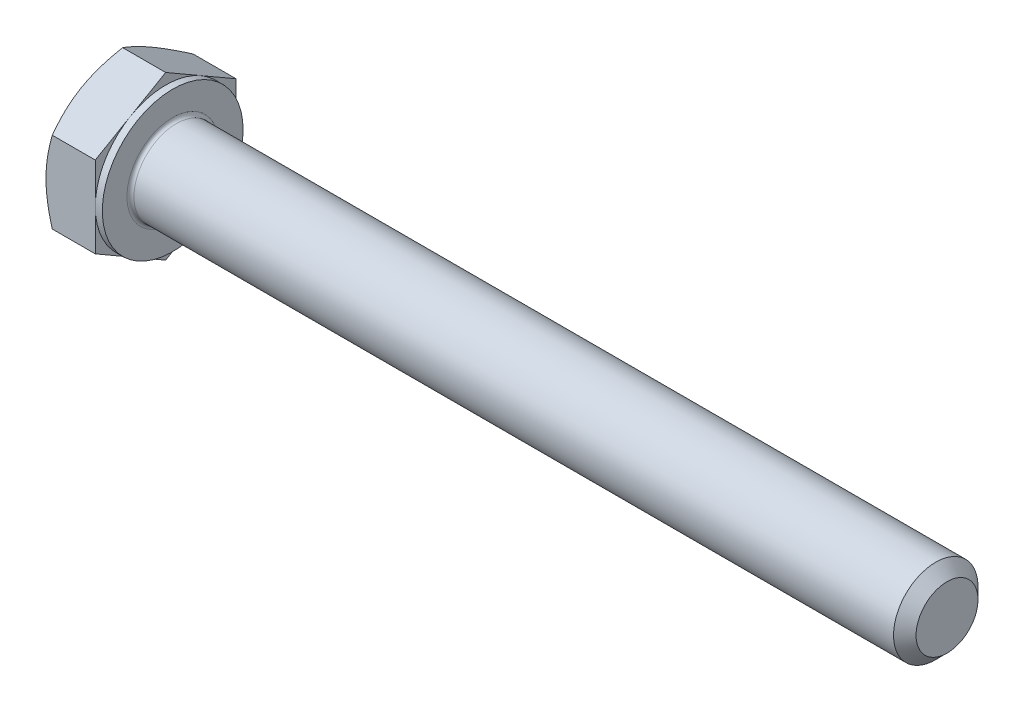
from build123d import *

# Parameters (mm, degrees)
EXTRUDE_370_DEPTH = 4
SKETCH_4_W        = 0.5
SKETCH_4_H        = 10.773502692
CHAMFER_2030_SIZE = 0.8
FILLET_2072_R     = 0.25


with BuildPart() as part:
    # 草图1 → Extrude 370 (new body)
    with BuildSketch(Plane(origin=(0, 0, 0), x_dir=(0, 0, -1), z_dir=(1, 0, 0))):
        Polygon((5, 2.886751346), (5, -2.886751346), (0, -5.773502692), (-5, -2.886751346), (-5, 2.886751346), (0, 5.773502692), align=None)
    extrude(amount=EXTRUDE_370_DEPTH)

    # 草图2 → 凸台-旋转1 (revolve)
    with BuildSketch(Plane.XY, mode=Mode.PRIVATE) as revolve_1_sk:
        Polygon((0, 0), (59, 0), (59, 2.134), (59, 3), (27.8072, 3), (0, 3), align=None)
    revolve(revolve_1_sk.sketch.rotate(Axis((0, 0, 0), (1, 0, 0)), 90), axis=Axis((0, 0, 0), (1, 0, 0)))

    # 草图3 → 切除-旋转1 (revolve, cut)
    with BuildSketch(Plane.XY):
        Polygon((0, 5), (3.333333333, 10.773502692), (3.333333333, 15.773502692), (-10, 15.773502692), (-10, 5), align=None)
    revolve(axis=Axis((0, 0, 0), (1, 0, 0)), mode=Mode.SUBTRACT)

    # 草图5 → 切除-旋转2 (revolve, cut)
    with BuildSketch(Plane.XY):
        Polygon((4, 5), (0.666666667, 10.773502692), (0.666666667, 15.773502692), (10.666666667, 15.773502692), (10.666666667, 5), align=None)
    revolve(axis=Axis((0, 0, 0), (1, 0, 0)), mode=Mode.SUBTRACT)

    # 草图4 → 切除-旋转3 (revolve, cut)
    with BuildSketch(Plane.XY, mode=Mode.PRIVATE) as cut_revolve_3_sk:
        with Locations((3.75, 10.386751346)):
            Rectangle(SKETCH_4_W, SKETCH_4_H)
    revolve(cut_revolve_3_sk.sketch.rotate(Axis((0, 0, 0), (1, 0, 0)), 270), axis=Axis((0, 0, 0), (1, 0, 0)), mode=Mode.SUBTRACT)

    # Chamfer 2030
    chamfer_2030_edges = [part.edges().sort_by_distance(p)[0] for p in [
        (59, 0, -3),
    ]]
    chamfer(chamfer_2030_edges, length=CHAMFER_2030_SIZE)

    # Fillet 2072
    fillet_2072_edges = [part.edges().sort_by_distance(p)[0] for p in [
        (4, 0, -3),
    ]]
    fillet(fillet_2072_edges, radius=FILLET_2072_R)


solid = part.part
